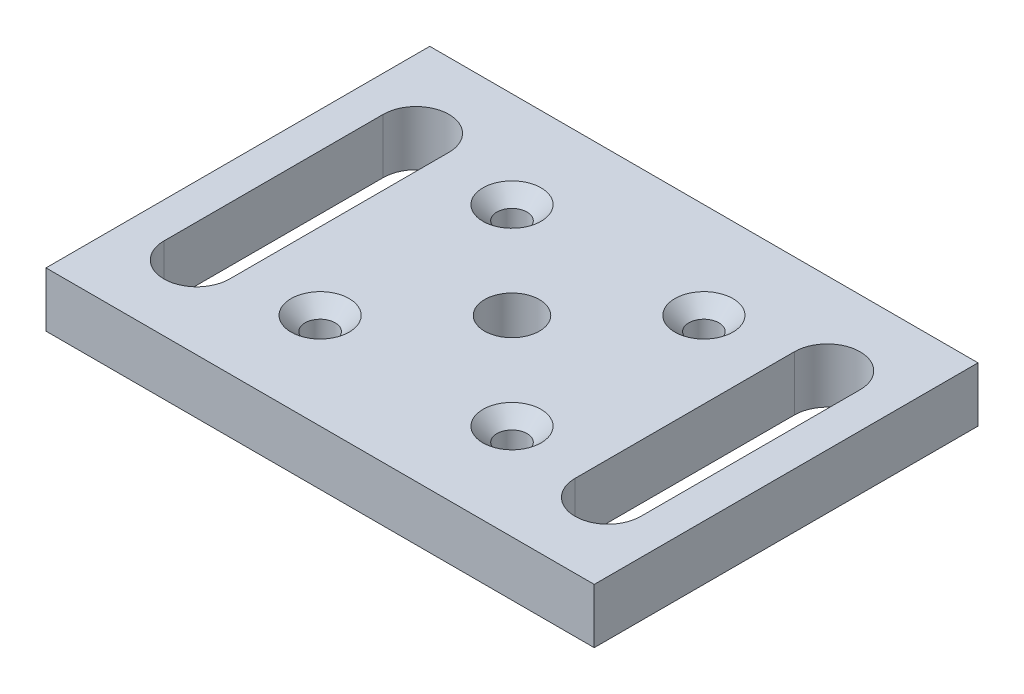
from build123d import *

# Parameters (mm, degrees)
SKETCH1_W                                           = 100
SKETCH1_H                                           = 70
SKETCH1_R                                           = 5
BOSS_EXTRUDE1_DEPTH                                 = 10
CSK_FOR_M5_COUNTERSUNK_FLAT_HEAD_SCREW1_D           = 5.5
CSK_FOR_M5_COUNTERSUNK_FLAT_HEAD_SCREW1_CSINK_D     = 10.6
CSK_FOR_M5_COUNTERSUNK_FLAT_HEAD_SCREW1_CSINK_ANGLE = 90


with BuildPart() as part:
    # Sketch1 → Boss-Extrude1 (new body)
    with BuildSketch(Plane(origin=(0, 0, 0), x_dir=(1, 0, 0), z_dir=(0, 1, 0))):
        with Locations((50, 35)):
            Rectangle(SKETCH1_W, SKETCH1_H)
        with Locations(Location((50, 35, 0), (0, 0, 270))):
            Circle(SKETCH1_R, mode=Mode.SUBTRACT)
        with BuildLine():
            Line((18.5, 55), (18.5, 15))
            ThreePointArc((18.5, 15), (12.5, 9), (6.5, 15))
            Line((6.5, 15), (6.5, 55))
            ThreePointArc((6.5, 55), (12.5, 61), (18.5, 55))
        make_face(mode=Mode.SUBTRACT)
        with BuildLine():
            Line((93.5, 55), (93.5, 15))
            ThreePointArc((93.5, 15), (87.5, 9), (81.5, 15))
            Line((81.5, 15), (81.5, 55))
            ThreePointArc((81.5, 55), (87.5, 61), (93.5, 55))
        make_face(mode=Mode.SUBTRACT)
    extrude(amount=BOSS_EXTRUDE1_DEPTH)

    # CSK for M5 Countersunk Flat Head Screw1 (through all)
    with Locations(Plane(origin=(0, 10, 0), x_dir=(1, 0, 0), z_dir=(0, 1, 0))):
        with Locations((32.5, 52.5), (67.5, 52.5), (67.5, 17.5), (32.5, 17.5)):
            CounterSinkHole(CSK_FOR_M5_COUNTERSUNK_FLAT_HEAD_SCREW1_D / 2, CSK_FOR_M5_COUNTERSUNK_FLAT_HEAD_SCREW1_CSINK_D / 2, counter_sink_angle=CSK_FOR_M5_COUNTERSUNK_FLAT_HEAD_SCREW1_CSINK_ANGLE)


solid = part.part
